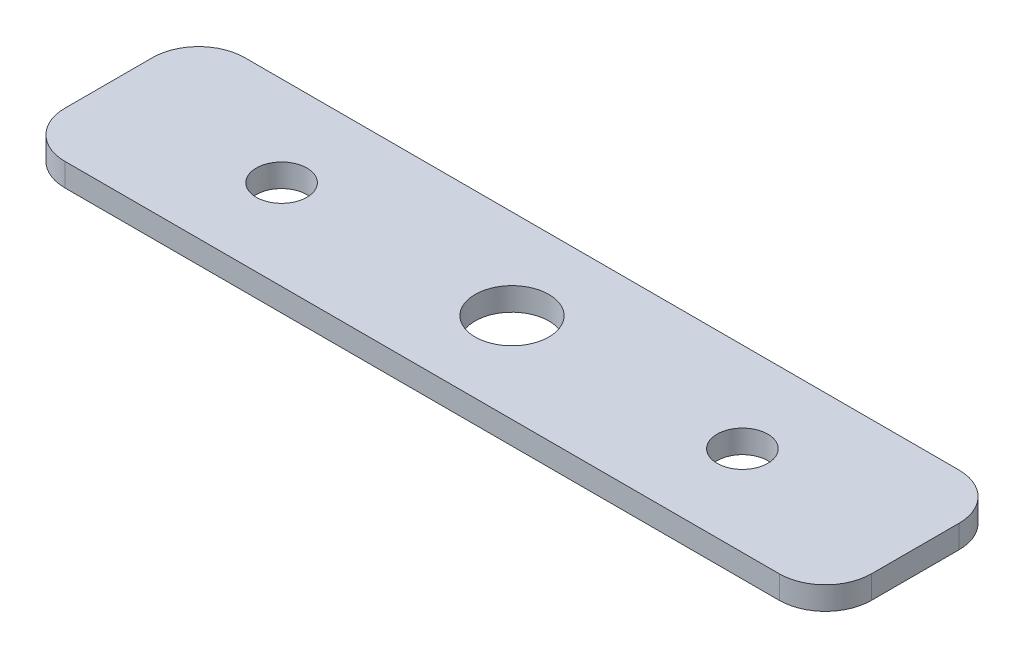
from build123d import *

# Parameters (mm, degrees)
CROQUIS1_W                 = 70
CROQUIS1_H                 = 15.6
SALIENTE_EXTRUIR1_DEPTH    = 2
CORTAR_EXTRUIR2_DEPTH      = 36.914342539
CORTAR_EXTRUIR2_DEPTH_BACK = 36.914342539
CROQUIS3_R                 = 3.2
CROQUIS3_R_2               = 2.2
REDONDEO1_R                = 4


with BuildPart() as part:
    # Croquis1 → Saliente-Extruir1 (new body)
    with BuildSketch(Plane(origin=(0, 0, 0), x_dir=(1, 0, 0), z_dir=(0, 1, 0))):
        Rectangle(CROQUIS1_W, CROQUIS1_H)
    extrude(amount=SALIENTE_EXTRUIR1_DEPTH)

    # Croquis3 → Cortar-Extruir2 (cut, two sides: drawn at the far end of the back side and taken through both)
    with BuildSketch(Plane(origin=(0, 0, 0), x_dir=(1, 0, 0), z_dir=(0, 1, 0)).offset(-CORTAR_EXTRUIR2_DEPTH_BACK)):
        with Locations(Location((0, 0, 0), (0, 0, 90))):
            Circle(CROQUIS3_R)
        with Locations(Location((20, 0, 0), (0, 0, 90))):
            Circle(CROQUIS3_R_2)
        with Locations(Location((-20, 0, 0), (0, 0, 90))):
            Circle(CROQUIS3_R_2)
    extrude(amount=CORTAR_EXTRUIR2_DEPTH + CORTAR_EXTRUIR2_DEPTH_BACK, mode=Mode.SUBTRACT)

    # Redondeo1
    redondeo1_edges = [part.edges().sort_by_distance(p)[0] for p in [
        (35, 1, 7.8),
        (-35, 1, 7.8),
        (-35, 1, -7.8),
        (35, 1, -7.8),
    ]]
    fillet(redondeo1_edges, radius=REDONDEO1_R)


solid = part.part
